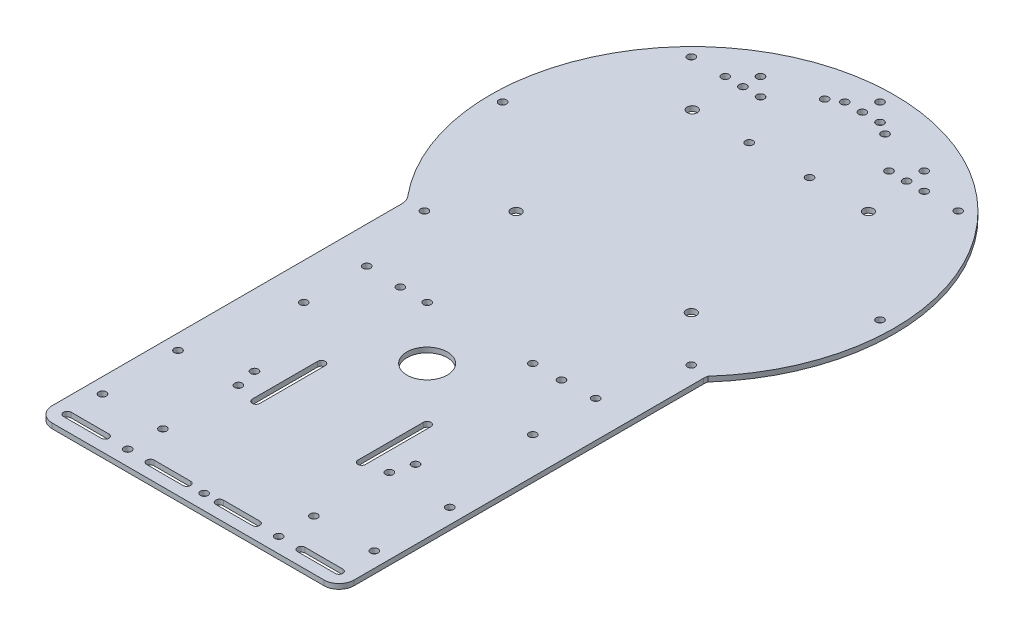
from build123d import *

# Parameters (mm, degrees)
SKETCH_1_R      = 2
SKETCH_1_R_2    = 1.5
SKETCH_1_R_3    = 8
EXTRUDE_1_DEPTH = 2


with BuildPart() as part:
    # 草图1 → 凸台-拉伸1 (new body)
    with BuildSketch(Plane(origin=(0, 0, 0), x_dir=(1, 0, 0), z_dir=(0, 1, 0))):
        with BuildLine():
            Line((394.734384308, 186.437991397), (394.734384308, 47.57418904))
            ThreePointArc((394.734384308, 47.57418904), (392.977024848, 43.331548206), (388.734383891, 41.574189041))
            Line((388.734383891, 41.574189041), (280.734383891, 41.574189041))
            ThreePointArc((280.734383891, 41.574189041), (276.491743156, 43.331548327), (274.734383818, 47.57418904))
            Line((274.734383818, 47.57418904), (274.734383818, 186.437990955))
            ThreePointArc((274.734383818, 186.437990955), (274.374769614, 188.48397581), (273.339034443, 190.284705955))
            ThreePointArc((273.339034443, 190.284705955), (336.622100005, 321.857720451), (394.944496295, 188.011903851))
            ThreePointArc((394.944496295, 188.011903851), (394.787144273, 187.231928967), (394.734384308, 186.437991397))
        make_face()
        with Locations(Location((370.121603429, 276.574189041, 0), (0, 0, 270))):
            Circle(SKETCH_1_R, mode=Mode.SUBTRACT)
        with Locations(Location((369.73616956, 206.574189041, 0), (0, 0, 270))):
            Circle(SKETCH_1_R, mode=Mode.SUBTRACT)
        with Locations(Location((300.121603429, 206.574189041, 0), (0, 0, 270))):
            Circle(SKETCH_1_R, mode=Mode.SUBTRACT)
        with Locations(Location((313.734383891, 157.57418904, 0), (0, 0, 270))):
            Circle(SKETCH_1_R_2, mode=Mode.SUBTRACT)
        with Locations(Location((355.734383891, 157.57418904, 0), (0, 0, 270))):
            Circle(SKETCH_1_R_2, mode=Mode.SUBTRACT)
        with Locations(Location((380.234383891, 133.07418904, 0), (0, 0, 270))):
            Circle(SKETCH_1_R_2, mode=Mode.SUBTRACT)
        with Locations(Location((380.234383891, 158.07418904, 0), (0, 0, 270))):
            Circle(SKETCH_1_R_2, mode=Mode.SUBTRACT)
        with Locations(Location((364.734383891, 61.57418904, 0), (0, 0, 270))):
            Circle(SKETCH_1_R_2, mode=Mode.SUBTRACT)
        with Locations(Location((388.734383891, 61.57418904, 0), (0, 0, 270))):
            Circle(SKETCH_1_R_2, mode=Mode.SUBTRACT)
        with Locations(Location((364.734383891, 91.57418904, 0), (0, 0, 270))):
            Circle(SKETCH_1_R_2, mode=Mode.SUBTRACT)
        with Locations(Location((388.734383891, 91.57418904, 0), (0, 0, 270))):
            Circle(SKETCH_1_R_2, mode=Mode.SUBTRACT)
        with Locations(Location((304.734383891, 61.57418904, 0), (0, 0, 270))):
            Circle(SKETCH_1_R_2, mode=Mode.SUBTRACT)
        with Locations(Location((280.734383891, 61.57418904, 0), (0, 0, 270))):
            Circle(SKETCH_1_R_2, mode=Mode.SUBTRACT)
        with Locations(Location((304.734383891, 91.57418904, 0), (0, 0, 270))):
            Circle(SKETCH_1_R_2, mode=Mode.SUBTRACT)
        with Locations(Location((280.734383891, 91.57418904, 0), (0, 0, 270))):
            Circle(SKETCH_1_R_2, mode=Mode.SUBTRACT)
        with Locations(Location((334.734383891, 316.57418904, 0), (0, 0, 270))):
            Circle(SKETCH_1_R_2, mode=Mode.SUBTRACT)
        with Locations(Location((281.701375302, 294.607197629, 0), (0, 0, 270))):
            Circle(SKETCH_1_R_2, mode=Mode.SUBTRACT)
        with Locations(Location((259.734383891, 241.574189041, 0), (0, 0, 270))):
            Circle(SKETCH_1_R_2, mode=Mode.SUBTRACT)
        with Locations(Location((281.701375302, 188.541180451, 0), (0, 0, 270))):
            Circle(SKETCH_1_R_2, mode=Mode.SUBTRACT)
        with Locations(Location((387.76739248, 188.541180451, 0), (0, 0, 270))):
            Circle(SKETCH_1_R_2, mode=Mode.SUBTRACT)
        with Locations(Location((409.734383891, 241.574189041, 0), (0, 0, 270))):
            Circle(SKETCH_1_R_2, mode=Mode.SUBTRACT)
        with Locations(Location((387.76739248, 294.607197629, 0), (0, 0, 270))):
            Circle(SKETCH_1_R_2, mode=Mode.SUBTRACT)
        with Locations(Location((322.734383891, 306.575974709, 0), (0, 0, 270))):
            Circle(SKETCH_1_R_2, mode=Mode.SUBTRACT)
        with Locations(Location((346.734383891, 306.575974709, 0), (0, 0, 270))):
            Circle(SKETCH_1_R_2, mode=Mode.SUBTRACT)
        with Locations(Location((322.734383891, 276.575974709, 0), (0, 0, 270))):
            Circle(SKETCH_1_R_2, mode=Mode.SUBTRACT)
        with Locations(Location((346.734383891, 276.575974709, 0), (0, 0, 270))):
            Circle(SKETCH_1_R_2, mode=Mode.SUBTRACT)
        with Locations(Location((334.734383891, 309.57418904, 0), (0, 0, 270))):
            Circle(SKETCH_1_R_2, mode=Mode.SUBTRACT)
        with Locations(Location((341.734383891, 309.57418904, 0), (0, 0, 270))):
            Circle(SKETCH_1_R_2, mode=Mode.SUBTRACT)
        with Locations(Location((327.734383891, 309.57418904, 0), (0, 0, 270))):
            Circle(SKETCH_1_R_2, mode=Mode.SUBTRACT)
        with Locations(Location((302.217879596, 301.607197629, 0), (0, 0, 270))):
            Circle(SKETCH_1_R_2, mode=Mode.SUBTRACT)
        with Locations(Location((302.217879596, 294.607197629, 0), (0, 0, 270))):
            Circle(SKETCH_1_R_2, mode=Mode.SUBTRACT)
        with Locations(Location((309.217879596, 294.607197629, 0), (0, 0, 270))):
            Circle(SKETCH_1_R_2, mode=Mode.SUBTRACT)
        with Locations(Location((295.217879596, 294.607197629, 0), (0, 0, 270))):
            Circle(SKETCH_1_R_2, mode=Mode.SUBTRACT)
        with Locations(Location((367.250888185, 301.607197629, 0), (0, 0, 270))):
            Circle(SKETCH_1_R_2, mode=Mode.SUBTRACT)
        with Locations(Location((367.250888185, 294.607197629, 0), (0, 0, 270))):
            Circle(SKETCH_1_R_2, mode=Mode.SUBTRACT)
        with Locations(Location((360.250888185, 294.607197629, 0), (0, 0, 270))):
            Circle(SKETCH_1_R_2, mode=Mode.SUBTRACT)
        with Locations(Location((374.250888185, 294.607197629, 0), (0, 0, 270))):
            Circle(SKETCH_1_R_2, mode=Mode.SUBTRACT)
        with Locations(Location((289.234383891, 133.07418904, 0), (0, 0, 270))):
            Circle(SKETCH_1_R_2, mode=Mode.SUBTRACT)
        with Locations(Location((289.234383891, 158.07418904, 0), (0, 0, 270))):
            Circle(SKETCH_1_R_2, mode=Mode.SUBTRACT)
        with Locations(Location((304.734383891, 47.57418904, 0), (0, 0, 270))):
            Circle(SKETCH_1_R_2, mode=Mode.SUBTRACT)
        with Locations(Location((364.734383891, 47.57418904, 0), (0, 0, 270))):
            Circle(SKETCH_1_R_2, mode=Mode.SUBTRACT)
        with Locations(Location((335.121603429, 47.57418904, 0), (0, 0, 270))):
            Circle(SKETCH_1_R_2, mode=Mode.SUBTRACT)
        with Locations(Location((334.734383891, 136.57418904, 0), (0, 0, 270))):
            Circle(SKETCH_1_R_3, mode=Mode.SUBTRACT)
        with Locations(Location((300.121603429, 276.574189041, 0), (0, 0, 270))):
            Circle(SKETCH_1_R, mode=Mode.SUBTRACT)
        with Locations(Location((367.121603429, 157.57418904, 0), (0, 0, 270))):
            Circle(SKETCH_1_R_2, mode=Mode.SUBTRACT)
        with Locations(Location((367.121603429, 99.57418904, 0), (0, 0, 270))):
            Circle(SKETCH_1_R_2, mode=Mode.SUBTRACT)
        with Locations(Location((303.121603429, 157.57418904, 0), (0, 0, 270))):
            Circle(SKETCH_1_R_2, mode=Mode.SUBTRACT)
        with Locations(Location((303.121603429, 99.57418904, 0), (0, 0, 270))):
            Circle(SKETCH_1_R_2, mode=Mode.SUBTRACT)
        with BuildLine():
            Line((354.234383891, 115.57418904), (354.234383891, 89.57418904))
            ThreePointArc((354.234383891, 89.57418904), (355.734383891, 88.07418904), (357.234383891, 89.57418904))
            Line((357.234383891, 89.57418904), (357.234383891, 115.57418904))
            ThreePointArc((357.234383891, 115.57418904), (355.734383891, 117.07418904), (354.234383891, 115.57418904))
        make_face(mode=Mode.SUBTRACT)
        with BuildLine():
            Line((312.234383891, 115.57418904), (312.234383891, 89.57418904))
            ThreePointArc((312.234383891, 89.57418904), (313.734383891, 88.07418904), (315.234383891, 89.57418904))
            Line((315.234383891, 89.57418904), (315.234383891, 115.57418904))
            ThreePointArc((315.234383891, 115.57418904), (313.734383891, 117.07418904), (312.234383891, 115.57418904))
        make_face(mode=Mode.SUBTRACT)
        with BuildLine():
            Line((373.73438389, 46.07418904), (388.734383949, 46.07418904))
            ThreePointArc((388.734383949, 46.07418904), (390.234384308, 47.574188681), (388.734384668, 49.07418904))
            Line((388.734384668, 49.07418904), (373.734383891, 49.07418904))
            ThreePointArc((373.734383891, 49.07418904), (372.234383891, 47.574189041), (373.73438389, 46.07418904))
        make_face(mode=Mode.SUBTRACT)
        with BuildLine():
            Line((295.734383891, 49.07418904), (280.734383933, 49.07418904))
            ThreePointArc((280.734383933, 49.07418904), (279.234383817, 47.574189156), (280.734383701, 46.07418904))
            Line((280.734383701, 46.07418904), (295.734383891, 46.07418904))
            ThreePointArc((295.734383891, 46.07418904), (297.234383891, 47.57418904), (295.734383891, 49.07418904))
        make_face(mode=Mode.SUBTRACT)
        with BuildLine():
            Line((341.23438389, 46.07418904), (355.734383901, 46.07418904))
            ThreePointArc((355.734383901, 46.07418904), (357.234383363, 47.574189579), (355.734382825, 49.07418904))
            Line((355.734382825, 49.07418904), (341.234383891, 49.07418904))
            ThreePointArc((341.234383891, 49.07418904), (339.734383891, 47.574189041), (341.23438389, 46.07418904))
        make_face(mode=Mode.SUBTRACT)
        with BuildLine():
            Line((328.234383891, 49.07418904), (313.734383817, 49.07418904))
            ThreePointArc((313.734383817, 49.07418904), (312.234383891, 47.5741895), (313.734382898, 46.07418904))
            Line((313.734382898, 46.07418904), (328.234383891, 46.07418904))
            ThreePointArc((328.234383891, 46.07418904), (329.734383891, 47.57418904), (328.234383891, 49.07418904))
        make_face(mode=Mode.SUBTRACT)
    extrude(amount=EXTRUDE_1_DEPTH)


solid = part.part
